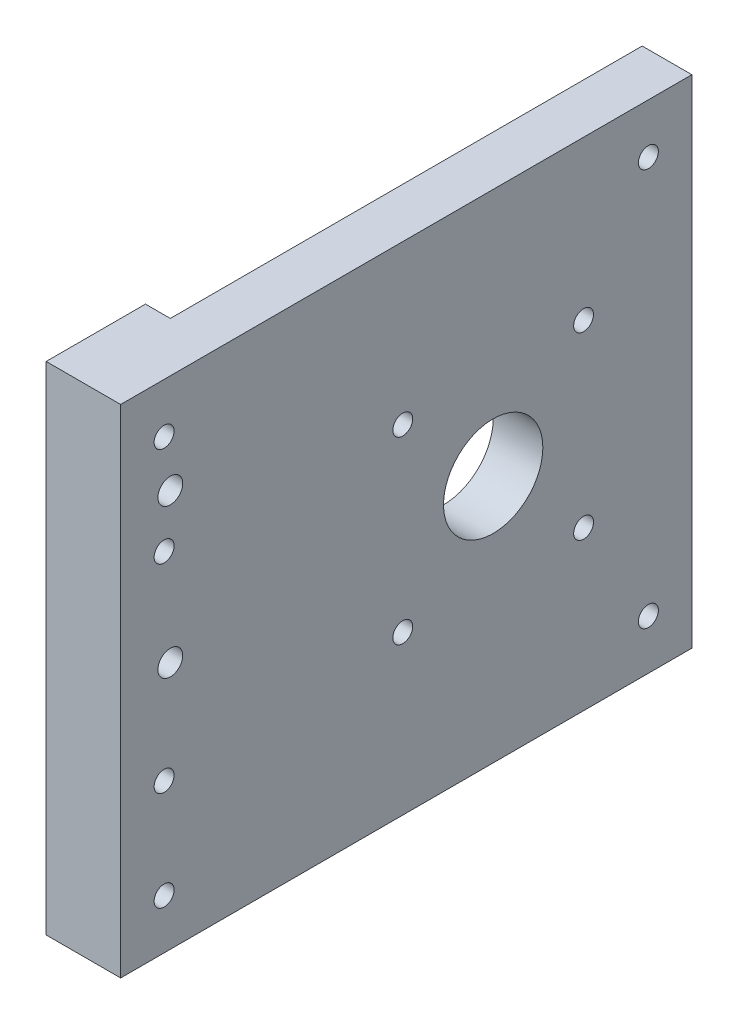
from build123d import *

# Parameters (mm, degrees)
SKETCH1_W               = 12.7
SKETCH1_H               = 127
BOSS_EXTRUDE1_DEPTH     = 146.05
SKETCH3_R               = 3.175
SKETCH3_R_2             = 12.7
SKETCH3_R_3             = 2.54
CUT_EXTRUDE1_DEPTH      = 12.7
SKETCH4_W               = 25.4
SKETCH4_H               = 127
BOSS_EXTRUDE2_DEPTH     = 6.35
SKETCH9_R               = 3.175
CUT_EXTRUDE2_DEPTH      = 194.961059236
F_1_4_20_TAPPED_HOLE1_D = 5.1054
F_1_4_20_TAPPED_HOLE2_D = 5.1054


with BuildPart() as part:
    # Sketch1 → Boss-Extrude1 (new body)
    with BuildSketch(Plane.XY):
        with Locations((6.35, 63.5)):
            Rectangle(SKETCH1_W, SKETCH1_H)
    extrude(amount=BOSS_EXTRUDE1_DEPTH)

    # Sketch3 → Cut-Extrude1 (cut)
    with BuildSketch(Plane(origin=(12.7, 0, 0), x_dir=(0, 0, -1), z_dir=(1, 0, 0))):
        with Locations((-133.35, 63.5)):
            Circle(SKETCH3_R)
        with Locations((-133.35, 101.6)):
            Circle(SKETCH3_R)
        with Locations((-50.8, 63.5)):
            Circle(SKETCH3_R_2)
        with Locations((-73.914, 86.487)):
            Circle(SKETCH3_R_3)
        with Locations((-27.686, 86.487)):
            Circle(SKETCH3_R_3)
        with Locations((-27.686, 40.513)):
            Circle(SKETCH3_R_3)
        with Locations((-73.914, 40.513)):
            Circle(SKETCH3_R_3)
    extrude(amount=-CUT_EXTRUDE1_DEPTH, mode=Mode.SUBTRACT)

    # Sketch4 → Boss-Extrude2 (add)
    with BuildSketch(Plane.ZY):
        with Locations((133.35, 63.5)):
            Rectangle(SKETCH4_W, SKETCH4_H)
    extrude(amount=BOSS_EXTRUDE2_DEPTH)

    # Sketch9 → Cut-Extrude2 (cut, through all)
    with BuildSketch(Plane(origin=(0, 0, 0), x_dir=(0, 0, -1), z_dir=(1, 0, 0))):
        with Locations((-133.35, 101.6)):
            Circle(SKETCH9_R)
        with Locations((-133.35, 63.5)):
            Circle(SKETCH9_R)
    extrude(amount=-CUT_EXTRUDE2_DEPTH, mode=Mode.SUBTRACT)

    # 1/4-20 Tapped Hole1 (through all)
    with Locations(Plane.ZY):
        with Locations((11.1125, 114.3), (11.1125, 12.7)):
            Hole(F_1_4_20_TAPPED_HOLE1_D / 2)

    # 1/4-20 Tapped Hole2 (through all)
    with Locations(Plane.ZY.offset(6.35)):
        with Locations((134.9375, 114.3), (134.9375, 88.9), (134.9375, 38.1), (134.9375, 12.7)):
            Hole(F_1_4_20_TAPPED_HOLE2_D / 2)


solid = part.part
